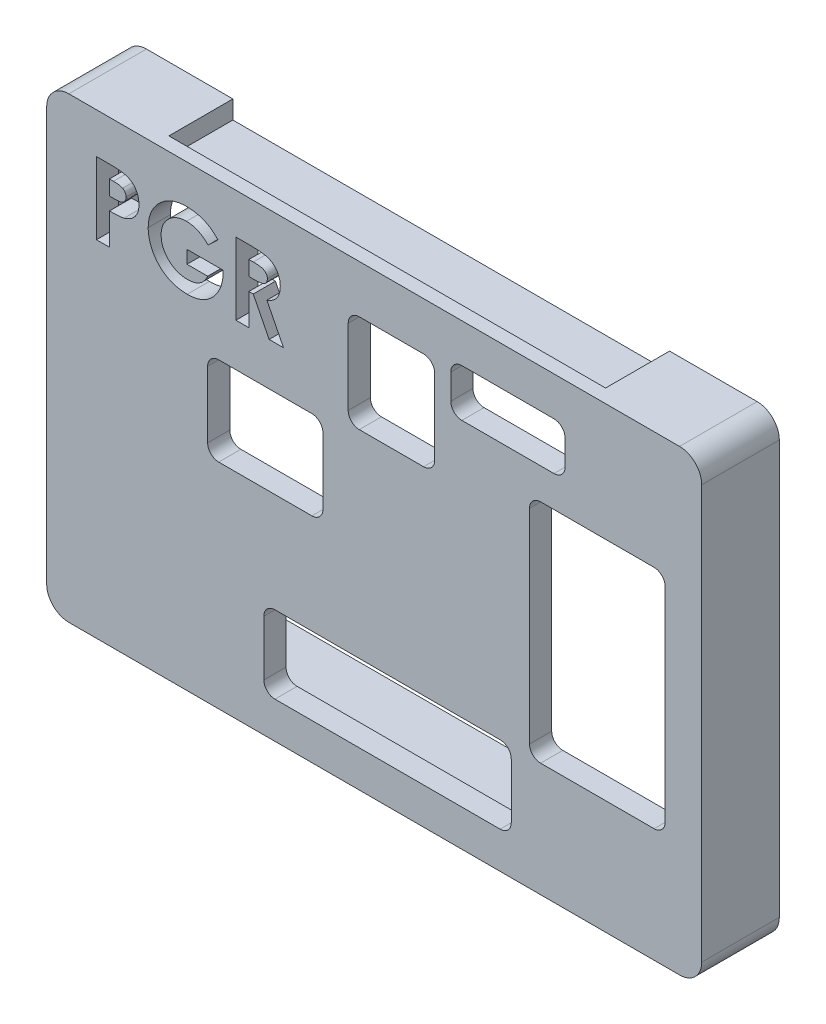
from build123d import *

# Parameters (mm, degrees)
DODANIE_WYCI_GNI_CIE2_DEPTH     = 6
SZKIC2_W                        = 4
SZKIC2_H                        = 13.832677946
WYTNIJ_WYCI_GNI_CIE1_DEPTH      = 6
WYTNIJ_WYCI_GNI_CIE2_DEPTH      = 39.4
DODANIE_WYCI_GNI_CIE3_START     = -1
DODANIE_WYCI_GNI_CIE3_DEPTH     = 1
DODANIE_WYCI_GNI_CIE4_DEPTH     = 1
WYTNIJ_WYCI_GNI_CIE5_DEPTH      = 38.461207317
WYTNIJ_WYCI_GNI_CIE5_DEPTH_BACK = 38.461207317
SZKIC7_W                        = 12.236191839
SZKIC7_H                        = 20.418316009
SZKIC7_W_2                      = 22.32064347
SZKIC7_H_2                      = 6.982314489
SZKIC7_W_3                      = 7.799543072
SZKIC7_H_3                      = 8.814117781
SZKIC7_W_4                      = 10.309898824
SZKIC7_H_4                      = 4.281074598
SZKIC7_W_5                      = 10.399390763
SZKIC7_H_5                      = 7.989775829
ZAOKR_GLENIE1_R                 = 1
WYTNIJ_WYCI_GNI_CIE6_DEPTH      = 38.634320156
WYTNIJ_WYCI_GNI_CIE6_DEPTH_BACK = 38.634320156


with BuildPart() as part:
    # Szkic1 → Dodanie-wyciągnięcie2 (new body)
    with BuildSketch(Plane.XY.offset(54.142497501)):
        with BuildLine():
            ThreePointArc((30.11092145, 17.836670655), (29.525135012, 19.250884217), (28.11092145, 19.836670655))
            Line((28.11092145, 19.836670655), (-26.989088551, 19.836670655))
            ThreePointArc((-26.989088551, 19.836670655), (-28.403302113, 19.250884217), (-28.989088551, 17.836670655))
            Line((-28.989088551, 17.836670655), (-28.989088551, 7.325452151))
            Line((-28.989088551, 7.325452151), (-25.989088551, 7.325452151))
            Line((-25.989088551, 7.325452151), (-25.989088551, 14.526780821))
            ThreePointArc((-25.989088551, 14.526780821), (-27.125972796, 17.973299374), (-23.679369964, 16.836670655))
            Line((-23.679369964, 16.836670655), (25.105290748, 16.836670655))
            ThreePointArc((25.105290748, 16.836670655), (25.586268211, 15.311972573), (27.11092145, 14.830852979))
            Line((27.11092145, 14.830852979), (27.11092145, -16.156090894))
            ThreePointArc((27.11092145, -16.156090894), (28.242076188, -19.599879634), (24.800064702, -18.463328332))
            Line((24.800064702, -18.463328332), (-23.983068356, -18.463328332))
            ThreePointArc((-23.983068356, -18.463328332), (-24.464318208, -16.938605941), (-25.989088551, -16.45750804))
            Line((-25.989088551, -16.45750804), (-25.989088551, -6.491488345))
            Line((-25.989088551, -6.491488345), (-28.989088551, -6.491488345))
            Line((-28.989088551, -6.491488345), (-28.989088551, -19.463328332))
            ThreePointArc((-28.989088551, -19.463328332), (-28.403302113, -20.877541894), (-26.989088551, -21.463328332))
            Line((-26.989088551, -21.463328332), (28.11092145, -21.463328332))
            ThreePointArc((28.11092145, -21.463328332), (29.525135012, -20.877541894), (30.11092145, -19.463328332))
            Line((30.11092145, -19.463328332), (30.11092145, 17.836670655))
        make_face()
    extrude(amount=DODANIE_WYCI_GNI_CIE2_DEPTH)

    # Szkic2 → Wytnij-wyciągnięcie1 (cut)
    with BuildSketch(Plane.ZY.offset(28.989088551)):
        with Locations((56.142497501, 0.424850628)):
            Rectangle(SZKIC2_W, SZKIC2_H)
    extrude(amount=-WYTNIJ_WYCI_GNI_CIE1_DEPTH, mode=Mode.SUBTRACT)

    # Szkic4 → Wytnij-wyciągnięcie2 (cut)
    with BuildSketch(Plane.ZY.offset(19.189088551)):
        Polygon((59.918947352, 19.986670655), (53.992497501, 19.986670655), (53.992497501, 18.186670655), (58.362699001, 18.186670655), (58.362699001, 17.486670655), (59.095470292, 17.486670655), (59.918947352, 18.793347846), align=None)
    wytnij_wyci_gni_cie2 = extrude(amount=-WYTNIJ_WYCI_GNI_CIE2_DEPTH, mode=Mode.SUBTRACT)

    # Lustro2: Wytnij-wyciągnięcie2 across plane
    add(wytnij_wyci_gni_cie2.mirror(Plane(origin=(0, -0.813328839, 0), x_dir=(0, 0, 1), z_dir=(0, -1, 0))), mode=Mode.SUBTRACT)

    # Szkic6 → Dodanie-wyciągnięcie3 (add)
    with BuildSketch(Plane.XY.offset(60.142497501).offset(DODANIE_WYCI_GNI_CIE3_START)):
        with BuildLine():
            Line((30.11092145, -19.463328332), (30.11092145, 17.836670655))
            ThreePointArc((30.11092145, 17.836670655), (29.525135012, 19.250884217), (28.11092145, 19.836670655))
            Line((28.11092145, 19.836670655), (20.212223662, 19.836670655))
            Line((20.212223662, 19.836670655), (20.212223662, 16.836670655))
            Line((20.212223662, 16.836670655), (-19.218141056, 16.836670655))
            Line((-19.218141056, 16.836670655), (-19.218141056, 19.836670655))
            Line((-19.218141056, 19.836670655), (-26.989088551, 19.836670655))
            ThreePointArc((-26.989088551, 19.836670655), (-28.403302113, 19.250884217), (-28.989088551, 17.836670655))
            Line((-28.989088551, 17.836670655), (-28.989088551, -19.463328332))
            ThreePointArc((-28.989088551, -19.463328332), (-28.403302113, -20.877541894), (-26.989088551, -21.463328332))
            Line((-26.989088551, -21.463328332), (-19.175571507, -21.463328332))
            Line((-19.175571507, -21.463328332), (-19.175571507, -18.463328332))
            Line((-19.175571507, -18.463328332), (20.212223662, -18.463328332))
            Line((20.212223662, -18.463328332), (20.212223662, -21.463328332))
            Line((20.212223662, -21.463328332), (28.11092145, -21.463328332))
            ThreePointArc((28.11092145, -21.463328332), (29.525135012, -20.877541894), (30.11092145, -19.463328332))
        make_face()
    extrude(amount=DODANIE_WYCI_GNI_CIE3_DEPTH)

    # Szkic9 → Dodanie-wyciągnięcie4 (add)
    with BuildSketch(Plane.XY.offset(60.142497501)):
        with BuildLine():
            Line((-28.989088551, 17.836670655), (-28.989088551, -19.463328332))
            ThreePointArc((-28.989088551, -19.463328332), (-28.403302113, -20.877541894), (-26.989088551, -21.463328332))
            Line((-26.989088551, -21.463328332), (28.11092145, -21.463328332))
            ThreePointArc((28.11092145, -21.463328332), (29.525135012, -20.877541894), (30.11092145, -19.463328332))
            Line((30.11092145, -19.463328332), (30.11092145, 17.836670655))
            ThreePointArc((30.11092145, 17.836670655), (29.525135012, 19.250884217), (28.11092145, 19.836670655))
            Line((28.11092145, 19.836670655), (-26.989088551, 19.836670655))
            ThreePointArc((-26.989088551, 19.836670655), (-28.403302113, 19.250884217), (-28.989088551, 17.836670655))
        make_face()
    extrude(amount=DODANIE_WYCI_GNI_CIE4_DEPTH)

    # Szkic7 → Wytnij-wyciągnięcie5 (cut, two sides: drawn at the far end of the back side and taken through both)
    with BuildSketch(Plane.XY.offset(60.142497501).offset(-WYTNIJ_WYCI_GNI_CIE5_DEPTH_BACK)):
        with Locations((20.692825531, -0.971856136)):
            Rectangle(SZKIC7_W, SZKIC7_H)
        with Locations((1.765723978, -14.672171386)):
            Rectangle(SZKIC7_W_2, SZKIC7_H_2)
        with Locations((2.114483972, 11.107923987)):
            Rectangle(SZKIC7_W_3, SZKIC7_H_3)
        with Locations((12.625088824, 14.190163885)):
            Rectangle(SZKIC7_W_4, SZKIC7_H_4)
        with Locations((-9.26777604, 1.818224312)):
            Rectangle(SZKIC7_W_5, SZKIC7_H_5)
    extrude(amount=WYTNIJ_WYCI_GNI_CIE5_DEPTH + WYTNIJ_WYCI_GNI_CIE5_DEPTH_BACK, mode=Mode.SUBTRACT)

    # Zaokrąglenie1
    zaokr_glenie1_edges = [part.edges().sort_by_distance(p)[0] for p in [
        (12.926045713, -11.181014141, 60.142497501),
        (12.926045713, -18.16332863, 60.142497501),
        (-9.394597757, -18.16332863, 60.142497501),
        (-9.394597757, -11.181014141, 60.142497501),
        (6.014255508, 15.514982877, 60.142497501),
        (6.014255508, 6.700865096, 60.142497501),
        (-1.785287564, 6.700865096, 60.142497501),
        (-1.785287564, 15.514982877, 60.142497501),
        (17.780038236, 16.330701184, 60.142497501),
        (17.780038236, 12.049626586, 60.142497501),
        (7.470139412, 12.049626586, 60.142497501),
        (7.470139412, 16.330701184, 60.142497501),
        (-14.467471421, -2.176663603, 60.142497501),
        (-14.467471421, 5.813112226, 60.142497501),
        (-4.068080658, 5.813112226, 60.142497501),
        (-4.068080658, -2.176663603, 60.142497501),
        (26.81092145, 9.237301868, 60.142497501),
        (26.81092145, -11.181014141, 60.142497501),
        (14.574729611, -11.181014141, 60.142497501),
        (14.574729611, 9.237301868, 60.142497501),
    ]]
    fillet(zaokr_glenie1_edges, radius=ZAOKR_GLENIE1_R)

    # Szkic10 → Wytnij-wyciągnięcie6 (cut, two sides: drawn at the far end of the back side and taken through both)
    # profile 1 of 3: a face of its own
    with BuildSketch(Plane.XY.offset(61.142497501).offset(-WYTNIJ_WYCI_GNI_CIE6_DEPTH_BACK)):
        with BuildLine():
            Line((-24.497327699, 16.181178303), (-23.195244365, 16.181178303))
            add(Edge.make_bspline(
                [(-23.195244365, 16.181178303), (-23.110167929, 16.180797482), (-22.946037652, 16.1800628), (-22.709348287, 16.171153803), (-22.49099076, 16.155188337), (-22.291015237, 16.135457547), (-22.109503942, 16.107795746), (-21.94622957, 16.076083657), (-21.801158238, 16.037449103), (-21.672654049, 15.991590423), (-21.557325691, 15.937524831), (-21.448187867, 15.879941116), (-21.347707104, 15.811216984), (-21.250811836, 15.738759228), (-21.16304173, 15.655645989), (-21.078921164, 15.567408571), (-21.002012871, 15.470547553), (-20.931960489, 15.366235411), (-20.868412184, 15.256399386), (-20.812892133, 15.140843126), (-20.767857377, 15.019383773), (-20.730078816, 14.892807032), (-20.699734709, 14.76111842), (-20.679536705, 14.623508039), (-20.665817204, 14.480936738), (-20.664606648, 14.383902621), (-20.663994365, 14.334824136)],
                knots=[0, 0, 0, 0, 1.698747864, 3.27724071, 4.728299578, 6.070144658, 7.288476769, 8.393259625, 9.389771311, 10.283485332, 11.113357557, 11.931608583, 12.74405601, 13.541433047, 14.344816069, 15.154114104, 15.974336324, 16.810834471, 17.661136416, 18.50621059, 19.367396281, 20.244825668, 21.142564693, 22.063065223, 23.020325768, 24, 24, 24, 24], degree=3))
            add(Edge.make_bspline(
                [(-20.663994365, 14.334824136), (-20.664880261, 14.280529777), (-20.666621155, 14.173834688), (-20.68368753, 14.017432779), (-20.71284229, 13.868317719), (-20.750946036, 13.725231994), (-20.804079, 13.590529682), (-20.864780917, 13.460996744), (-20.939463528, 13.340264886), (-21.024800351, 13.226823897), (-21.117997897, 13.11975145), (-21.221268672, 13.022139058), (-21.332644291, 12.933321302), (-21.451480039, 12.852367364), (-21.578222063, 12.779440546), (-21.712778912, 12.713857966), (-21.856069415, 12.657717159), (-21.955852611, 12.628355971), (-22.006442282, 12.613469969)],
                knots=[0, 0, 0, 0, 1.102006807, 2.165578795, 3.188629044, 4.184801286, 5.166646146, 6.124351954, 7.085497154, 8.042432466, 9.003981491, 9.963833307, 10.922997304, 11.89326795, 12.880200226, 13.889073926, 14.929769137, 16, 16, 16, 16], degree=3))
            add(Edge.make_bspline(
                [(-22.006442282, 12.613469969), (-22.039763549, 12.605179584), (-22.111948145, 12.58721994), (-22.231393823, 12.568986393), (-22.369042427, 12.552221768), (-22.525339063, 12.537814603), (-22.70037384, 12.528021087), (-22.89397728, 12.520372787), (-23.10623712, 12.514811683), (-23.253834219, 12.514614351), (-23.330661032, 12.514511636)],
                knots=[0, 0, 0, 0, 0.618981996, 1.340914327, 2.176866532, 3.120127938, 4.170906482, 5.338178032, 6.614476169, 8, 8, 8, 8], degree=3))
            Line((-23.330661032, 12.514511636), (-23.330661032, 9.681178303))
            Line((-23.330661032, 9.681178303), (-24.497327699, 9.681178303))
            Line((-24.497327699, 9.681178303), (-24.497327699, 16.181178303))
        make_face()
        with BuildLine():
            Line((-23.330661032, 13.681178303), (-22.917900615, 13.681178303))
            add(Edge.make_bspline(
                [(-22.917900615, 13.681178303), (-22.842792341, 13.681654547), (-22.704592, 13.682530845), (-22.515859138, 13.695202615), (-22.364189779, 13.714554968), (-22.24436817, 13.742310717), (-22.14975766, 13.784433741), (-22.068162018, 13.833162149), (-21.998175353, 13.894777882), (-21.937577202, 13.9651844), (-21.889130807, 14.046085018), (-21.855535755, 14.136162427), (-21.83371307, 14.233524003), (-21.831697542, 14.301281216), (-21.830661032, 14.336126219)],
                knots=[0, 0, 0, 0, 1.8619151, 3.425951444, 4.686033666, 5.651700536, 6.461346321, 7.243864085, 7.999046032, 8.762387399, 9.539336099, 10.322741239, 11.137448474, 12, 12, 12, 12], degree=3))
            add(Edge.make_bspline(
                [(-21.830661032, 14.336126219), (-21.83168688, 14.366569845), (-21.833677274, 14.425637799), (-21.848299243, 14.510887507), (-21.871602456, 14.590357821), (-21.905367915, 14.66321878), (-21.949018659, 14.729346579), (-22.002237749, 14.78871517), (-22.064342281, 14.842595981), (-22.11229061, 14.871115917), (-22.136650615, 14.885605386)],
                knots=[0, 0, 0, 0, 1.102301479, 2.1387299, 3.123554645, 4.094223062, 5.036071848, 5.982632524, 6.975082478, 8, 8, 8, 8], degree=3))
            add(Edge.make_bspline(
                [(-22.136650615, 14.885605386), (-22.157284946, 14.896040759), (-22.200972053, 14.918134581), (-22.275375431, 14.943820265), (-22.361235793, 14.96548897), (-22.459132794, 14.983473785), (-22.568675893, 14.997431869), (-22.689845547, 15.008106312), (-22.822820069, 15.012398921), (-22.915295892, 15.013787974), (-22.963473532, 15.014511636)],
                knots=[0, 0, 0, 0, 0.656809284, 1.390599849, 2.23162475, 3.173112763, 4.218524733, 5.370385145, 6.63003504, 8, 8, 8, 8], degree=3))
            Line((-22.963473532, 15.014511636), (-23.330661032, 15.014511636))
            Line((-23.330661032, 15.014511636), (-23.330661032, 13.681178303))
        make_face(mode=Mode.SUBTRACT)
    # profile 2 of 3: a face of its own
    with BuildSketch(Plane.XY.offset(61.142497501).offset(-WYTNIJ_WYCI_GNI_CIE6_DEPTH_BACK)):
        with BuildLine():
            Line((-13.540296449, 15.147324136), (-14.423108949, 14.302272053))
            add(Edge.make_bspline(
                [(-14.423108949, 14.302272053), (-14.493002755, 14.372249604), (-14.630145941, 14.509557112), (-14.854426467, 14.688272271), (-15.086713024, 14.840215485), (-15.327770162, 14.965153825), (-15.577933673, 15.062066864), (-15.836709879, 15.131391861), (-16.104519775, 15.172509692), (-16.28581512, 15.178266048), (-16.377536032, 15.181178303)],
                knots=[0, 0, 0, 0, 1.075575784, 2.110457258, 3.113929901, 4.09197124, 5.059417775, 6.02750972, 7.002078037, 8, 8, 8, 8], degree=3))
            add(Edge.make_bspline(
                [(-16.377536032, 15.181178303), (-16.457055258, 15.179137699), (-16.613198229, 15.175130794), (-16.842635287, 15.144702637), (-17.06187645, 15.093873768), (-17.271957505, 15.023458857), (-17.471595832, 14.931826802), (-17.661948175, 14.820391837), (-17.841843103, 14.688301476), (-18.009864073, 14.538059691), (-18.162847707, 14.374025996), (-18.296410497, 14.19845194), (-18.410177301, 14.014610073), (-18.503830583, 13.821559833), (-18.575090546, 13.619597515), (-18.625960834, 13.408869732), (-18.658250818, 13.189988889), (-18.662063301, 13.040666111), (-18.663994365, 12.965032469)],
                knots=[0, 0, 0, 0, 1.075001177, 2.110859044, 3.123021556, 4.114053297, 5.101481495, 6.087880186, 7.091499647, 8.114004866, 9.131394192, 10.11971144, 11.092043119, 12.050101265, 13.015322563, 13.981809771, 14.977764287, 16, 16, 16, 16], degree=3))
            add(Edge.make_bspline(
                [(-18.663994365, 12.965032469), (-18.66219316, 12.886781046), (-18.658644541, 12.732615029), (-18.624556035, 12.506369773), (-18.572036824, 12.288705532), (-18.495162702, 12.081237327), (-18.400553939, 11.881123131), (-18.280574439, 11.692239348), (-18.140666337, 11.511701515), (-17.981079627, 11.342652899), (-17.807490499, 11.186830759), (-17.619487826, 11.05241457), (-17.422791802, 10.936442413), (-17.214227742, 10.844596214), (-16.997415704, 10.770853778), (-16.770156588, 10.718859032), (-16.532962129, 10.686960436), (-16.371126488, 10.683124867), (-16.288994365, 10.681178303)],
                knots=[0, 0, 0, 0, 1.022067601, 2.013613092, 2.983553406, 3.943623673, 4.90013463, 5.87121881, 6.861774014, 7.881098904, 8.905697761, 9.905387765, 10.89678721, 11.884561068, 12.87834324, 13.885584958, 14.926927371, 16, 16, 16, 16], degree=3))
            add(Edge.make_bspline(
                [(-16.288994365, 10.681178303), (-16.235570461, 10.681660337), (-16.130687449, 10.682606679), (-15.976841944, 10.697968459), (-15.829494902, 10.719929909), (-15.688075689, 10.749004262), (-15.55401226, 10.790149689), (-15.425448414, 10.838264198), (-15.303137423, 10.895048913), (-15.187742443, 10.962463011), (-15.077546064, 11.038025976), (-14.973579744, 11.124486075), (-14.874019791, 11.219893953), (-14.780029552, 11.325415151), (-14.693199838, 11.441993155), (-14.610748845, 11.567485686), (-14.533620624, 11.703138184), (-14.488047593, 11.798929106), (-14.464775615, 11.847844969)],
                knots=[0, 0, 0, 0, 1.109579412, 2.178351274, 3.208885622, 4.204702371, 5.174744997, 6.119429583, 7.05542196, 7.97267548, 8.893247984, 9.828544973, 10.778894627, 11.756245826, 12.760884819, 13.796418446, 14.874735809, 16, 16, 16, 16], degree=3))
            Line((-14.464775615, 11.847844969), (-16.330661032, 11.847844969))
            Line((-16.330661032, 11.847844969), (-16.330661032, 13.014511636))
            Line((-16.330661032, 13.014511636), (-13.089775615, 13.014511636))
            Line((-13.089775615, 13.014511636), (-13.080661032, 12.737167886))
            add(Edge.make_bspline(
                [(-13.080661032, 12.737167886), (-13.081832188, 12.665938974), (-13.08417241, 12.523608264), (-13.105559587, 12.311702084), (-13.140987119, 12.1026064), (-13.189419947, 11.896531223), (-13.250118532, 11.69246568), (-13.327528229, 11.492363867), (-13.418174511, 11.294868763), (-13.519737239, 11.100819567), (-13.633864524, 10.914624087), (-13.756739303, 10.738321547), (-13.886609913, 10.572217089), (-14.026300987, 10.418624963), (-14.173637305, 10.276254928), (-14.328908899, 10.145654698), (-14.492664957, 10.02671377), (-14.664037998, 9.918427365), (-14.844004157, 9.823520719), (-15.03157398, 9.740964528), (-15.226464263, 9.670851299), (-15.429178165, 9.613373703), (-15.639316798, 9.569025165), (-15.856884662, 9.538615314), (-16.082001248, 9.517951479), (-16.234693066, 9.515672112), (-16.312431865, 9.514511636)],
                knots=[0, 0, 0, 0, 1.006889344, 2.011981806, 3.007738725, 4.003571281, 5.003404394, 6.015442001, 7.03424805, 8.074616296, 9.110249922, 10.119753985, 11.111721717, 12.089233633, 13.052717867, 14.006597561, 14.955430184, 15.912305663, 16.870361111, 17.829300583, 18.807640451, 19.796414044, 20.806216501, 21.841577364, 22.90109906, 24, 24, 24, 24], degree=3))
            add(Edge.make_bspline(
                [(-16.312431865, 9.514511636), (-16.395373893, 9.515657628), (-16.55978973, 9.517929325), (-16.802900581, 9.539205318), (-17.038958635, 9.574319971), (-17.268022771, 9.62291745), (-17.490624829, 9.683400895), (-17.706382343, 9.759321926), (-17.914854033, 9.849632393), (-18.116664173, 9.95194084), (-18.30923341, 10.067967531), (-18.492130164, 10.195677924), (-18.664356151, 10.335893521), (-18.827675499, 10.486267084), (-18.978272437, 10.650494808), (-19.121759123, 10.823253276), (-19.251184119, 11.01087858), (-19.372112316, 11.207287852), (-19.479545892, 11.412398787), (-19.573498099, 11.622417752), (-19.653620488, 11.836128735), (-19.716798928, 12.054526848), (-19.768093905, 12.276089235), (-19.804796423, 12.501779421), (-19.82552405, 12.731569153), (-19.828941103, 12.885999756), (-19.830661032, 12.963730386)],
                knots=[0, 0, 0, 0, 1.084149091, 2.14910686, 3.187506334, 4.202448172, 5.208724393, 6.201130722, 7.189831603, 8.176984443, 9.156919086, 10.126598231, 11.090766514, 12.05840148, 13.026036446, 14.001772938, 14.991905635, 16.003017641, 17.015720547, 18.016462227, 19.009322657, 19.99686681, 20.986544154, 21.980959929, 22.983742515, 24, 24, 24, 24], degree=3))
            add(Edge.make_bspline(
                [(-19.830661032, 12.963730386), (-19.82835768, 13.069771576), (-19.823809242, 13.279171486), (-19.78168381, 13.587618883), (-19.716016537, 13.886010963), (-19.621777389, 14.173261002), (-19.500846307, 14.449764691), (-19.354936392, 14.716171134), (-19.180878161, 14.972197166), (-19.046145136, 15.130712838), (-18.977796449, 15.211126219)],
                knots=[0, 0, 0, 0, 1.034044851, 2.041932006, 3.031217818, 4.011390712, 4.986069675, 5.97149666, 6.970960976, 8, 8, 8, 8], degree=3))
            add(Edge.make_bspline(
                [(-18.977796449, 15.211126219), (-18.935359416, 15.257647798), (-18.851122546, 15.349992431), (-18.716470061, 15.478307178), (-18.578402752, 15.598927787), (-18.435008364, 15.709296575), (-18.287040694, 15.811829565), (-18.134073867, 15.904604698), (-17.976910309, 15.99057598), (-17.814324337, 16.065353393), (-17.64716711, 16.132397582), (-17.474698314, 16.189126392), (-17.298209707, 16.239374635), (-17.116138475, 16.27760066), (-16.930323971, 16.309432376), (-16.739447224, 16.330767659), (-16.544028382, 16.346404903), (-16.411856906, 16.34736115), (-16.344983949, 16.347844969)],
                knots=[0, 0, 0, 0, 1.020590567, 2.025856924, 3.013483481, 3.991664875, 4.957826714, 5.930500614, 6.890802512, 7.860442893, 8.829981142, 9.809047939, 10.802672283, 11.803273349, 12.823572789, 13.857849586, 14.916166035, 16, 16, 16, 16], degree=3))
            add(Edge.make_bspline(
                [(-16.344983949, 16.347844969), (-16.275079996, 16.34676693), (-16.135996799, 16.344622028), (-15.929203117, 16.329780705), (-15.725282972, 16.306884042), (-15.525095703, 16.27253774), (-15.327969481, 16.2301816), (-15.134924679, 16.175912902), (-14.944701917, 16.114253886), (-14.82086762, 16.065094763), (-14.759046449, 16.040553303)],
                knots=[0, 0, 0, 0, 1.03180557, 2.052914215, 3.058998889, 4.059601663, 5.049854447, 6.033765722, 7.018406786, 8, 8, 8, 8], degree=3))
            add(Edge.make_bspline(
                [(-14.759046449, 16.040553303), (-14.70703158, 16.017872575), (-14.601234777, 15.971740604), (-14.447313468, 15.887339998), (-14.293016087, 15.793772239), (-14.140007581, 15.687616274), (-13.988521093, 15.569070662), (-13.836974942, 15.440007812), (-13.686916166, 15.298922777), (-13.589802631, 15.198511453), (-13.540296449, 15.147324136)],
                knots=[0, 0, 0, 0, 0.894392155, 1.819168899, 2.76525314, 3.739198753, 4.75366411, 5.797420238, 6.877176959, 8, 8, 8, 8], degree=3))
        make_face()
    # profile 3 of 3: a face of its own
    with BuildSketch(Plane.XY.offset(61.142497501).offset(-WYTNIJ_WYCI_GNI_CIE6_DEPTH_BACK)):
        with BuildLine():
            Line((-11.913994365, 16.181178303), (-10.554619365, 16.181178303))
            add(Edge.make_bspline(
                [(-10.554619365, 16.181178303), (-10.464765091, 16.180859372), (-10.291950013, 16.180245977), (-10.042760108, 16.170568239), (-9.813844911, 16.157100872), (-9.604865492, 16.136549313), (-9.415911257, 16.10930043), (-9.246792829, 16.077178506), (-9.097515151, 16.040568686), (-8.966819272, 15.994949963), (-8.848872703, 15.943492734), (-8.738930104, 15.884367435), (-8.634565977, 15.818232445), (-8.536477882, 15.743347572), (-8.443813412, 15.661059977), (-8.35639775, 15.571286829), (-8.27546616, 15.47326689), (-8.201519773, 15.367619521), (-8.134123593, 15.256480912), (-8.074559506, 15.139698467), (-8.026121891, 15.017190974), (-7.983322066, 14.89072893), (-7.952494739, 14.758504535), (-7.931054783, 14.621805016), (-7.915357287, 14.480149177), (-7.914454756, 14.383914489), (-7.913994365, 14.334824136)],
                knots=[0, 0, 0, 0, 1.749336639, 3.364467119, 4.854658419, 6.213483162, 7.451590619, 8.570285859, 9.5643256, 10.440900261, 11.26203566, 12.067320669, 12.869050712, 13.665104639, 14.467235401, 15.27997916, 16.102287765, 16.939272006, 17.78853747, 18.631303466, 19.488103222, 20.351255419, 21.228522269, 22.127379805, 23.044756219, 24, 24, 24, 24], degree=3))
            add(Edge.make_bspline(
                [(-7.913994365, 14.334824136), (-7.915190295, 14.283585084), (-7.917535295, 14.183114643), (-7.930166743, 14.035531758), (-7.95325306, 13.894334778), (-7.988220647, 13.759937108), (-8.028411346, 13.630666013), (-8.081854666, 13.508906627), (-8.142170736, 13.392888134), (-8.213806369, 13.284251661), (-8.292422976, 13.180584174), (-8.383852437, 13.085857559), (-8.482171527, 12.99498062), (-8.592907119, 12.91364558), (-8.711177886, 12.836352857), (-8.839333744, 12.766305066), (-8.976538304, 12.701741367), (-9.072999904, 12.665736188), (-9.122327699, 12.647324136)],
                knots=[0, 0, 0, 0, 1.099860209, 2.156625411, 3.176576793, 4.16617041, 5.135385252, 6.078461593, 7.016046972, 7.938469504, 8.868247731, 9.803980173, 10.76021508, 11.73834243, 12.748633912, 13.790971185, 14.870363756, 16, 16, 16, 16], degree=3))
            Line((-9.122327699, 12.647324136), (-7.622327699, 9.681178303))
            Line((-7.622327699, 9.681178303), (-8.919202699, 9.681178303))
            Line((-8.919202699, 9.681178303), (-10.351494365, 12.514511636))
            Line((-10.351494365, 12.514511636), (-10.747327699, 12.514511636))
            Line((-10.747327699, 12.514511636), (-10.747327699, 9.681178303))
            Line((-10.747327699, 9.681178303), (-11.913994365, 9.681178303))
            Line((-11.913994365, 9.681178303), (-11.913994365, 16.181178303))
        make_face()
        with BuildLine():
            Line((-10.747327699, 13.681178303), (-10.292900615, 13.681178303))
            add(Edge.make_bspline(
                [(-10.292900615, 13.681178303), (-10.237343127, 13.681804028), (-10.130962474, 13.683002159), (-9.977973124, 13.688559584), (-9.839022308, 13.701950233), (-9.713513324, 13.718868818), (-9.600814624, 13.738403768), (-9.501931438, 13.766398536), (-9.415340129, 13.79639564), (-9.342066806, 13.833674258), (-9.279463763, 13.876068132), (-9.225410043, 13.924228627), (-9.180699865, 13.979968267), (-9.143901109, 14.04177229), (-9.115275677, 14.110187337), (-9.094381304, 14.184462366), (-9.08270444, 14.265443464), (-9.081360977, 14.321331449), (-9.080661032, 14.350449136)],
                knots=[0, 0, 0, 0, 1.688639943, 3.233382647, 4.650958383, 5.928841754, 7.082724185, 8.122798841, 9.049171256, 9.863274652, 10.613301712, 11.341792392, 12.054588806, 12.776240173, 13.521029143, 14.301969904, 15.115324896, 16, 16, 16, 16], degree=3))
            add(Edge.make_bspline(
                [(-9.080661032, 14.350449136), (-9.081984343, 14.384897485), (-9.084583742, 14.452564884), (-9.110377854, 14.54998221), (-9.151436509, 14.640148611), (-9.20771668, 14.722656692), (-9.278594238, 14.794988972), (-9.359931828, 14.858750453), (-9.453484911, 14.909168261), (-9.540108026, 14.94242331), (-9.618914814, 14.962320149), (-9.690035453, 14.977147097), (-9.772393582, 14.987655381), (-9.866051375, 14.998801287), (-9.970770097, 15.006028843), (-10.087120527, 15.011303518), (-10.214768506, 15.013461646), (-10.303751272, 15.014151562), (-10.350192282, 15.014511636)],
                knots=[0, 0, 0, 0, 1.020303359, 2.004196876, 2.966617323, 3.9489082, 4.950758222, 5.960522915, 7.003732012, 8.091992268, 8.70421221, 9.413913587, 10.24622431, 11.166358409, 12.212345909, 13.359657661, 14.621978493, 16, 16, 16, 16], degree=3))
            Line((-10.350192282, 15.014511636), (-10.747327699, 15.014511636))
            Line((-10.747327699, 15.014511636), (-10.747327699, 13.681178303))
        make_face(mode=Mode.SUBTRACT)
    extrude(amount=WYTNIJ_WYCI_GNI_CIE6_DEPTH + WYTNIJ_WYCI_GNI_CIE6_DEPTH_BACK, mode=Mode.SUBTRACT)


with BuildPart() as wytnij_wyci_gni_cie6_piece_1:
    # of the separate pieces the step leaves, piece 1, a body of its own (wytnij_wyci_gni_cie6_pieces)
    add(part.part.solids().sort_by_distance((-28.989088551, 17.836670655, 61.142497501))[0])


with BuildPart() as wytnij_wyci_gni_cie6_piece_2:
    # of the separate pieces the step leaves, piece 2, a body of its own (wytnij_wyci_gni_cie6_pieces)
    add(part.part.solids().sort_by_distance((-10.292900615, 13.681178303, 61.142497501))[0])


with BuildPart() as wytnij_wyci_gni_cie6_piece_3:
    # of the separate pieces the step leaves, piece 3, a body of its own (wytnij_wyci_gni_cie6_pieces)
    add(part.part.solids().sort_by_distance((-21.830661032, 14.336126219, 61.142497501))[0])


solid = Compound([wytnij_wyci_gni_cie6_piece_1.part, wytnij_wyci_gni_cie6_piece_2.part, wytnij_wyci_gni_cie6_piece_3.part])
